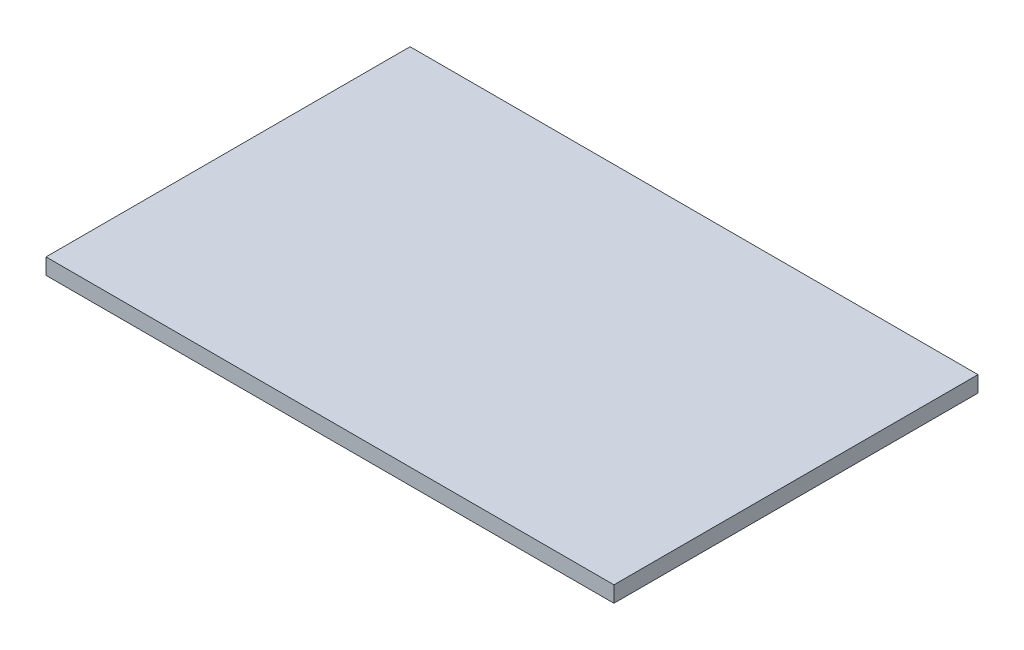
from build123d import *

# Parameters (mm, degrees)
SKETCH_1_W      = 39
SKETCH_1_H      = 25
EXTRUDE_1_DEPTH = 1.1


with BuildPart() as part:
    # 草图1 → 凸台-拉伸1 (new body)
    with BuildSketch(Plane(origin=(0, 0, 0), x_dir=(1, 0, 0), z_dir=(0, 1, 0))):
        with Locations((19.5, 12.5)):
            Rectangle(SKETCH_1_W, SKETCH_1_H)
    extrude(amount=EXTRUDE_1_DEPTH)


solid = part.part
